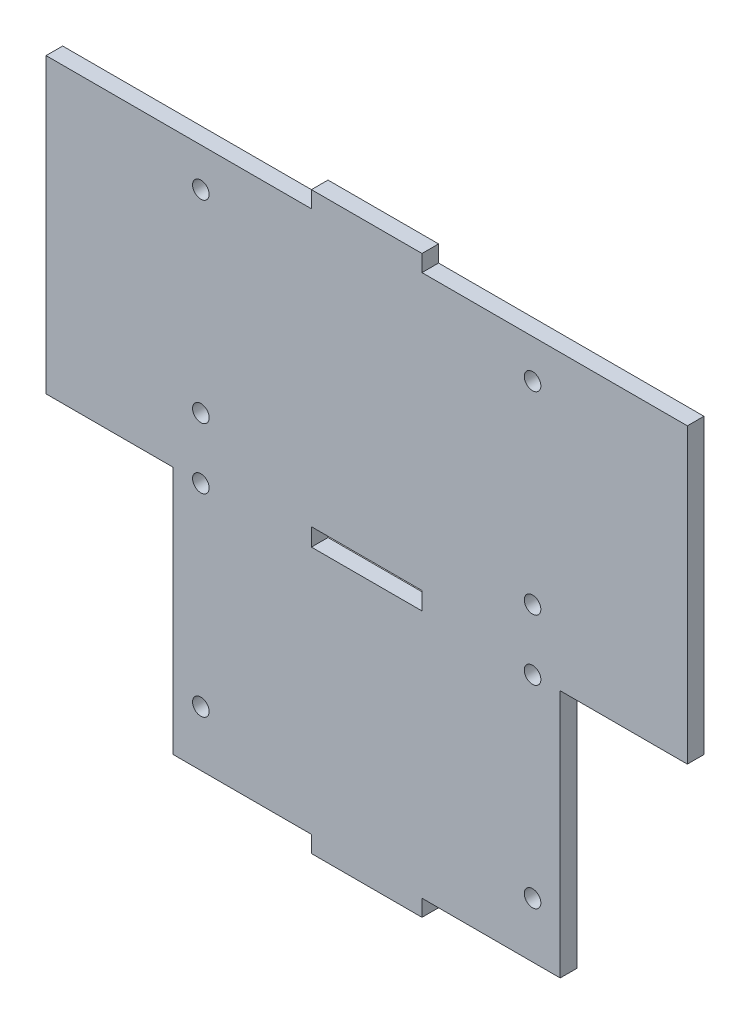
from build123d import *

# Parameters (mm, degrees)
SKETCH1_R           = 1.5
SKETCH1_W           = 20
SKETCH1_H           = 3.2
BOSS_EXTRUDE1_DEPTH = 3


with BuildPart() as part:
    # Sketch1 → Boss-Extrude1 (new body)
    with BuildSketch(Plane.XY):
        Polygon((10, -48), (-10, -48), (-10, -45), (-35, -45), (-35, 0), (-58, 0), (-58, 53), (-10, 53), (-10, 56), (10, 56), (10, 53), (58, 53), (58, 0), (35, 0), (35, -45), (10, -45), align=None)
        with Locations((-30, 0)):
            Circle(SKETCH1_R, mode=Mode.SUBTRACT)
        with Locations((-30, -35)):
            Circle(SKETCH1_R, mode=Mode.SUBTRACT)
        with Locations((30, 0)):
            Circle(SKETCH1_R, mode=Mode.SUBTRACT)
        with Locations((30, -35)):
            Circle(SKETCH1_R, mode=Mode.SUBTRACT)
        with Locations((-30, 11)):
            Circle(SKETCH1_R, mode=Mode.SUBTRACT)
        with Locations((-30, 46)):
            Circle(SKETCH1_R, mode=Mode.SUBTRACT)
        with Locations((30, 46)):
            Circle(SKETCH1_R, mode=Mode.SUBTRACT)
        with Locations((30, 11)):
            Circle(SKETCH1_R, mode=Mode.SUBTRACT)
        with Locations((0, 1.6)):
            Rectangle(SKETCH1_W, SKETCH1_H, mode=Mode.SUBTRACT)
    extrude(amount=BOSS_EXTRUDE1_DEPTH)


solid = part.part
